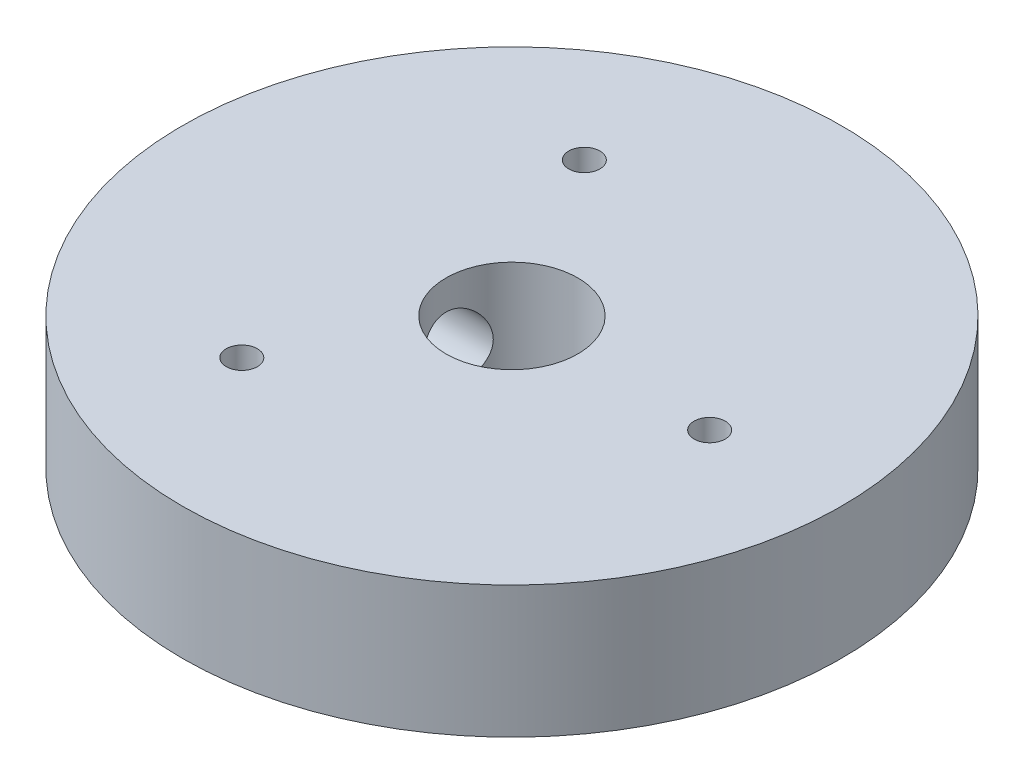
from build123d import *

# Parameters (mm, degrees)
SKETCH1_R           = 15.875
SKETCH1_R_2         = 3.175
SKETCH1_R_3         = 0.750387242
BOSS_EXTRUDE2_DEPTH = 3.175
SKETCH3_R           = 1.750000056
CUT_EXTRUDE1_DEPTH  = 23.674035261


with BuildPart() as part:
    # Sketch1 → Boss-Extrude2 (new, symmetric)
    with BuildSketch(Plane(origin=(0, 0, 0), x_dir=(1, 0, 0), z_dir=(0, 1, 0))):
        with Locations(Location((0, 0, 0), (0, 0, 270))):
            Circle(SKETCH1_R)
        with Locations(Location((0, 0, 0), (0, 0, 270))):
            Circle(SKETCH1_R_2, mode=Mode.SUBTRACT)
        with Locations(Location((9.525, 0, 0), (0, 0, 270))):
            Circle(SKETCH1_R_3, mode=Mode.SUBTRACT)
        with Locations(Location((-4.7625, -8.248891971, 0), (0, 0, 270))):
            Circle(SKETCH1_R_3, mode=Mode.SUBTRACT)
        with Locations(Location((-4.7625, 8.248891971, 0), (0, 0, 270))):
            Circle(SKETCH1_R_3, mode=Mode.SUBTRACT)
    extrude(amount=BOSS_EXTRUDE2_DEPTH, both=True)

    # Sketch3 → Cut-Extrude1 (cut, through all)
    with BuildSketch(Plane(origin=(0, 0, 0), x_dir=(0, 0, -1), z_dir=(1, 0, 0))):
        Circle(SKETCH3_R)
    extrude(amount=-CUT_EXTRUDE1_DEPTH, mode=Mode.SUBTRACT)


solid = part.part
